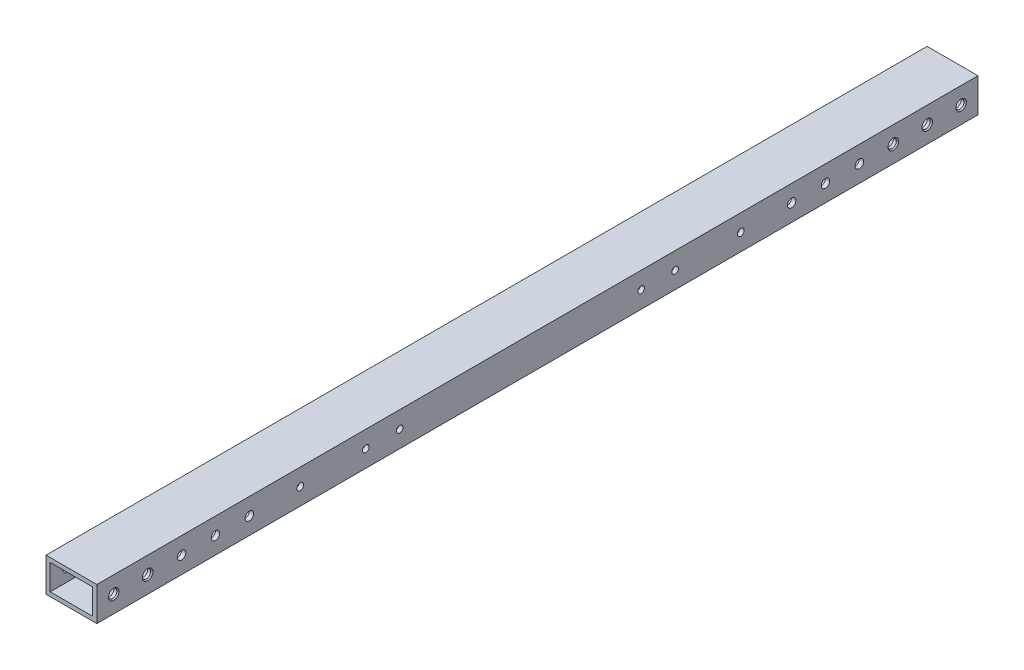
from build123d import *

# Parameters (mm, degrees)
BOSS_EXTRUDE1_DEPTH                  = 330.200001
BOSS_EXTRUDE1_DEPTH_BACK             = 330.200001
SKETCH3_W                            = 38.1
SKETCH3_H                            = 25.4
SKETCH3_W_2                          = 31.75
SKETCH3_H_2                          = 19.05
F_1_4_0_25_DIAMETER_HOLE2_AT_2_COUNT = 2
F_1_4_0_25_DIAMETER_HOLE2_AT_2_PITCH = 25.4
F_1_4_0_25_DIAMETER_HOLE2_AT_3_COUNT = 2
F_1_4_0_25_DIAMETER_HOLE2_AT_3_PITCH = 635.000000508
F_1_4_0_25_DIAMETER_HOLE2_AT_4_COUNT = 2
F_1_4_0_25_DIAMETER_HOLE2_AT_4_PITCH = 50.8
F_1_4_0_25_DIAMETER_HOLE2_AT_5_COUNT = 2
F_1_4_0_25_DIAMETER_HOLE2_AT_5_PITCH = 609.600000508
F_1_4_0_25_DIAMETER_HOLE3_D          = 6.35
F_13_64_0_20313_DIAMETER_HOLE1_D     = 5.159502
F_10_CLEARANCE_HOLE1_D               = 4.9784


with BuildPart() as part:
    # Sketch3 → Boss-Extrude1 (new, two sides: drawn at the far end of the back side and taken through both)
    with BuildSketch(Plane.XY.offset(-BOSS_EXTRUDE1_DEPTH_BACK)):
        Rectangle(SKETCH3_W, SKETCH3_H)
        Rectangle(SKETCH3_W_2, SKETCH3_H_2, mode=Mode.SUBTRACT)
    extrude(amount=BOSS_EXTRUDE1_DEPTH + BOSS_EXTRUDE1_DEPTH_BACK)

    # Sketch8 → 1/4 (0.25) Diameter Hole2 (revolve, cut)
    with BuildSketch(Plane(origin=(-19.05, 0, -317.500000508), x_dir=(0, 0, 1), z_dir=(0, 1, 0))):
        Polygon((0, 0), (0, 38.1), (3.9624, 38.1), (3.175, 37.194199916), (3.175, 0), align=None)
    f_1_4_0_25_diameter_hole2 = revolve(axis=Axis((-25.4, 0, -317.500000508), (1, 0, 0)), mode=Mode.SUBTRACT)

    # 1/4 (0.25) Diameter Hole2 at 2: 1/4 (0.25) Diameter Hole2 ×2
    with Locations(*[(0, 0, i * F_1_4_0_25_DIAMETER_HOLE2_AT_2_PITCH) for i in range(1, F_1_4_0_25_DIAMETER_HOLE2_AT_2_COUNT)]):
        add(f_1_4_0_25_diameter_hole2, mode=Mode.SUBTRACT)

    # 1/4 (0.25) Diameter Hole2 at 3: 1/4 (0.25) Diameter Hole2 ×2
    with Locations(*[(0, 0, i * F_1_4_0_25_DIAMETER_HOLE2_AT_3_PITCH) for i in range(1, F_1_4_0_25_DIAMETER_HOLE2_AT_3_COUNT)]):
        add(f_1_4_0_25_diameter_hole2, mode=Mode.SUBTRACT)

    # 1/4 (0.25) Diameter Hole2 at 4: 1/4 (0.25) Diameter Hole2 ×2
    with Locations(*[(0, 0, i * F_1_4_0_25_DIAMETER_HOLE2_AT_4_PITCH) for i in range(1, F_1_4_0_25_DIAMETER_HOLE2_AT_4_COUNT)]):
        add(f_1_4_0_25_diameter_hole2, mode=Mode.SUBTRACT)

    # 1/4 (0.25) Diameter Hole2 at 5: 1/4 (0.25) Diameter Hole2 ×2
    with Locations(*[(0, 0, i * F_1_4_0_25_DIAMETER_HOLE2_AT_5_PITCH) for i in range(1, F_1_4_0_25_DIAMETER_HOLE2_AT_5_COUNT)]):
        add(f_1_4_0_25_diameter_hole2, mode=Mode.SUBTRACT)

    # 1/4 (0.25) Diameter Hole3 (through all)
    with Locations(Plane(origin=(19.05, 0, 0), x_dir=(0, 0, -1), z_dir=(1, 0, 0))):
        with Locations((-266.7, 0), (-241.3, 0), (-215.9, 0), (241.300000508, 0), (215.900000508, 0), (190.500000508, 0)):
            Hole(F_1_4_0_25_DIAMETER_HOLE3_D / 2)

    # 13/64 (0.20313) Diameter Hole1 (through all)
    with Locations(Plane(origin=(19.05, 0, 0), x_dir=(0, 0, -1), z_dir=(1, 0, 0))):
        with Locations((152.400000508, 0), (-177.799999492, 0)):
            Hole(F_13_64_0_20313_DIAMETER_HOLE1_D / 2)

    # #10 Clearance Hole1 (through all)
    with Locations(Plane(origin=(19.05, 0, 0), x_dir=(0, 0, -1), z_dir=(1, 0, 0))):
        with Locations((-128.5875, 0), (-103.1875, 0), (77.787500575, 1.014e-06), (103.187500575, 1.014e-06)):
            Hole(F_10_CLEARANCE_HOLE1_D / 2)


solid = part.part
